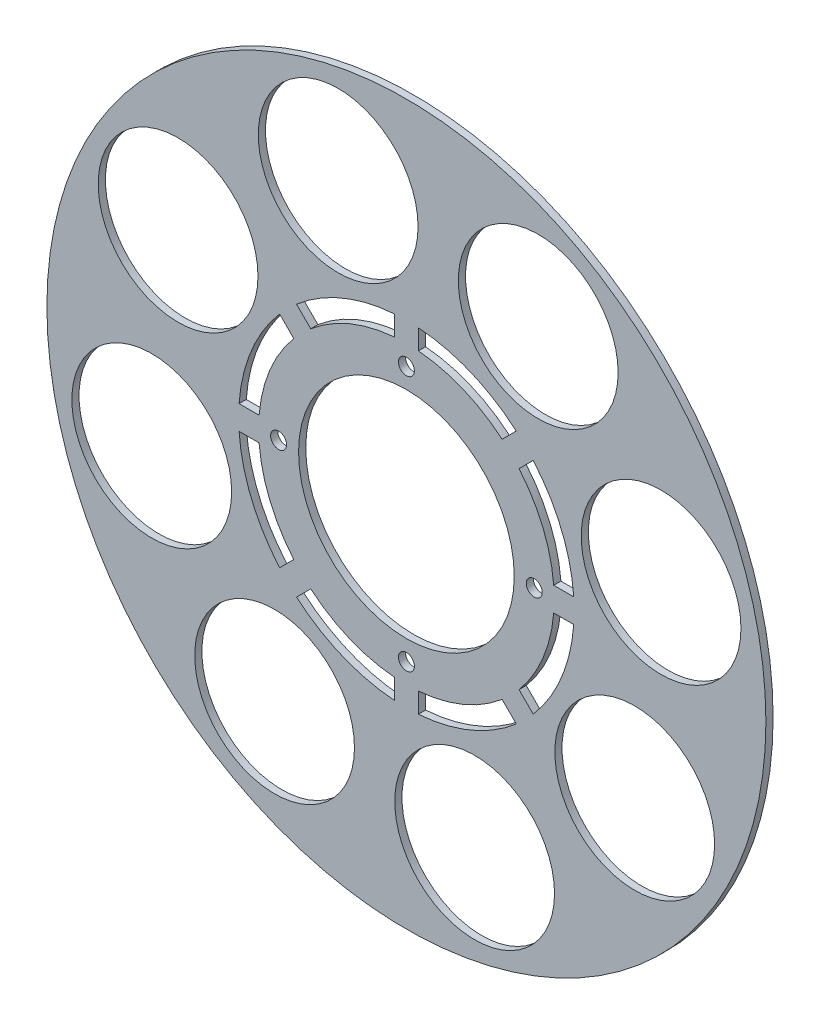
from build123d import *

# Parameters (mm, degrees)
SKETCH_1_R               = 37
SKETCH_1_R_2             = 2
SKETCH_1_R_3             = 27
EXTRUDE_1_DEPTH          = 3
SKETCH_2_R               = 90
SKETCH_2_R_2             = 20
SKETCH_2_R_3             = 42
EXTRUDE_2_DEPTH          = 3
EXTRUDE_3_DEPTH          = 3
CUT_EXTRUDE_1_DEPTH      = 128.314571044
CUT_EXTRUDE_1_DEPTH_BACK = 128.314571044
SKETCH_5_R               = 20
CUT_EXTRUDE_2_DEPTH      = 128.314571044
CUT_EXTRUDE_2_DEPTH_BACK = 128.314571044


with BuildPart() as part:
    # 草图1 → 凸台-拉伸1 (new body)
    with BuildSketch(Plane.XY):
        Circle(SKETCH_1_R)
        with Locations((-32, 0)):
            Circle(SKETCH_1_R_2, mode=Mode.SUBTRACT)
        with Locations((0, 32)):
            Circle(SKETCH_1_R_2, mode=Mode.SUBTRACT)
        with Locations((32, 0)):
            Circle(SKETCH_1_R_2, mode=Mode.SUBTRACT)
        with Locations((0, -32)):
            Circle(SKETCH_1_R_2, mode=Mode.SUBTRACT)
        Circle(SKETCH_1_R_3, mode=Mode.SUBTRACT)
    extrude(amount=EXTRUDE_1_DEPTH)



with BuildPart() as body_2:
    # 草图2 → 凸台-拉伸2 (new body)
    with BuildSketch(Plane.XY.offset(3)):
        Circle(SKETCH_2_R)
        with Locations((-63.751104535, -17.082056977)):
            Circle(SKETCH_2_R_2, mode=Mode.SUBTRACT)
        with Locations((-17.082056977, 63.751104535)):
            Circle(SKETCH_2_R_2, mode=Mode.SUBTRACT)
        with Locations((63.751104535, 17.082056977)):
            Circle(SKETCH_2_R_2, mode=Mode.SUBTRACT)
        with Locations((17.082056977, -63.751104535)):
            Circle(SKETCH_2_R_2, mode=Mode.SUBTRACT)
        Circle(SKETCH_2_R_3, mode=Mode.SUBTRACT)
    extrude(amount=-EXTRUDE_2_DEPTH)


with BuildPart() as part_1:
    add(part.part)

    add(body_2.part)  # 凸台-拉伸3 merges body 2
    # 草图3 → 凸台-拉伸3 (add)
    with BuildSketch(Plane.XY.offset(3)):
        Polygon((-41.892720131, 3), (-34.060564973, 3), (-34.060564973, -3), (-43.204810996, -3), (-43.204810996, 3), align=None)
        Polygon((-28.429094491, 32.671735178), (-27.501306144, 31.743946831), (-21.96313612, 26.205776807), (-26.205776807, 21.96313612), (-32.671735178, 28.429094491), align=None)
        Polygon((3, 43.204810996), (3, 41.892720131), (3, 34.060564973), (-3, 34.060564973), (-3, 43.204810996), align=None)
        Polygon((32.671735178, 28.429094491), (31.743946831, 27.501306144), (26.205776807, 21.96313612), (21.96313612, 26.205776807), (28.429094491, 32.671735178), align=None)
        Polygon((43.204810996, -3), (41.892720131, -3), (34.060564973, -3), (34.060564973, 3), (43.204810996, 3), align=None)
        Polygon((28.429094491, -32.671735178), (27.501306144, -31.743946831), (21.96313612, -26.205776807), (26.205776807, -21.96313612), (32.671735178, -28.429094491), align=None)
        Polygon((-3, -43.204810996), (-3, -41.892720131), (-3, -34.060564973), (3, -34.060564973), (3, -43.204810996), align=None)
        Polygon((-32.671735178, -28.429094491), (-31.743946831, -27.501306144), (-26.205776807, -21.96313612), (-21.96313612, -26.205776807), (-28.429094491, -32.671735178), align=None)
    extrude(amount=-EXTRUDE_3_DEPTH)

    # 草图5 → 切除-拉伸1 (cut, two sides: drawn at the far end of the back side and taken through both)
    with BuildSketch(Plane.XY.offset(3).offset(-CUT_EXTRUDE_1_DEPTH_BACK)):
        with Locations((-57.15767665, 33)):
            Circle(SKETCH_5_R)
        with Locations((33, 57.15767665)):
            Circle(SKETCH_5_R)
        with Locations((57.15767665, -33)):
            Circle(SKETCH_5_R)
        with Locations((-33, -57.15767665)):
            Circle(SKETCH_5_R)
    extrude(amount=CUT_EXTRUDE_1_DEPTH + CUT_EXTRUDE_1_DEPTH_BACK, mode=Mode.SUBTRACT)

    # 草图6 → 切除-拉伸2 (cut, two sides: drawn at the far end of the back side and taken through both)
    with BuildSketch(Plane(origin=(0, 0, 0), x_dir=(1, 0, 0), z_dir=(0, 1, 0)).offset(-CUT_EXTRUDE_2_DEPTH_BACK)):
        Polygon((100.374072396, 28.225781081), (-90, 7.369193783), (-90, 0), (-90, -1.2), (96.19546412, -1.2), align=None)
    extrude(amount=CUT_EXTRUDE_2_DEPTH + CUT_EXTRUDE_2_DEPTH_BACK, mode=Mode.SUBTRACT)


solid = part_1.part
